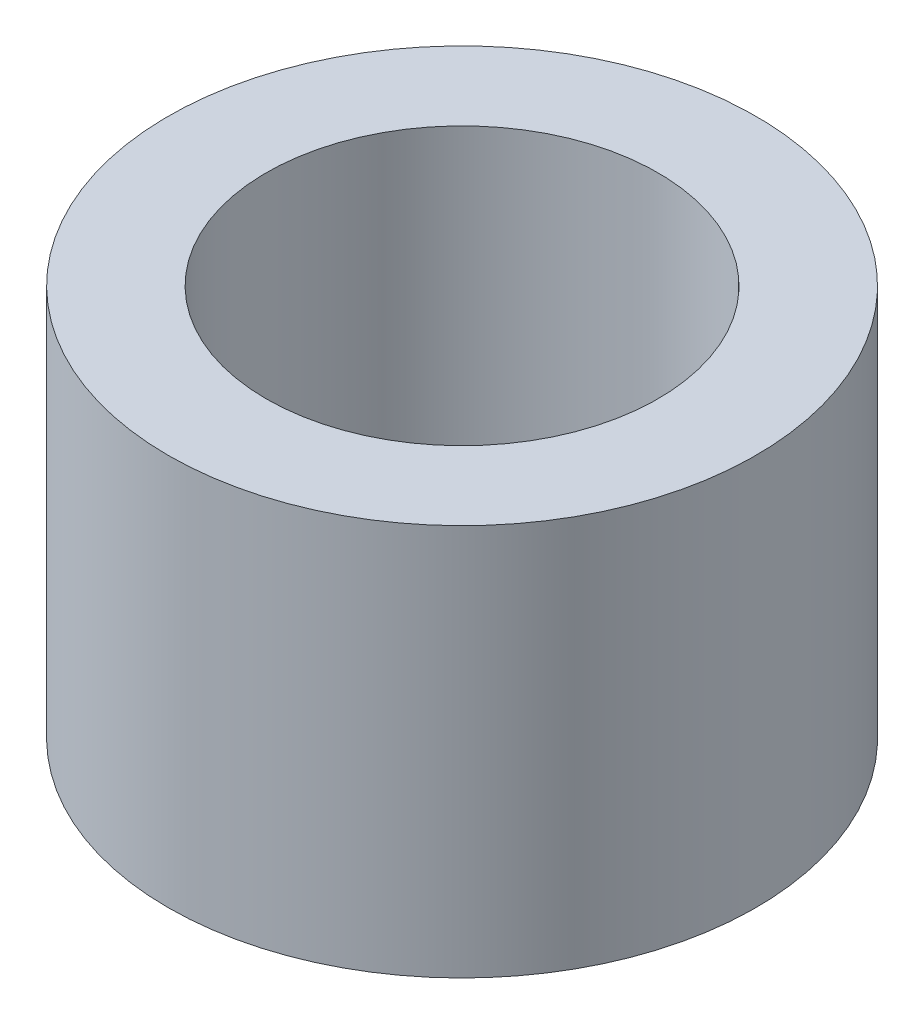
from build123d import *

# Parameters (mm, degrees)
SKETCH1_R           = 3.81
SKETCH1_R_2         = 2.54
BOSS_EXTRUDE1_DEPTH = 5.08


with BuildPart() as part:
    # Sketch1 → Boss-Extrude1 (new body)
    with BuildSketch(Plane(origin=(0, 0, 0), x_dir=(1, 0, 0), z_dir=(0, 1, 0))):
        Circle(SKETCH1_R)
        Circle(SKETCH1_R_2, mode=Mode.SUBTRACT)
    extrude(amount=BOSS_EXTRUDE1_DEPTH)


solid = part.part
